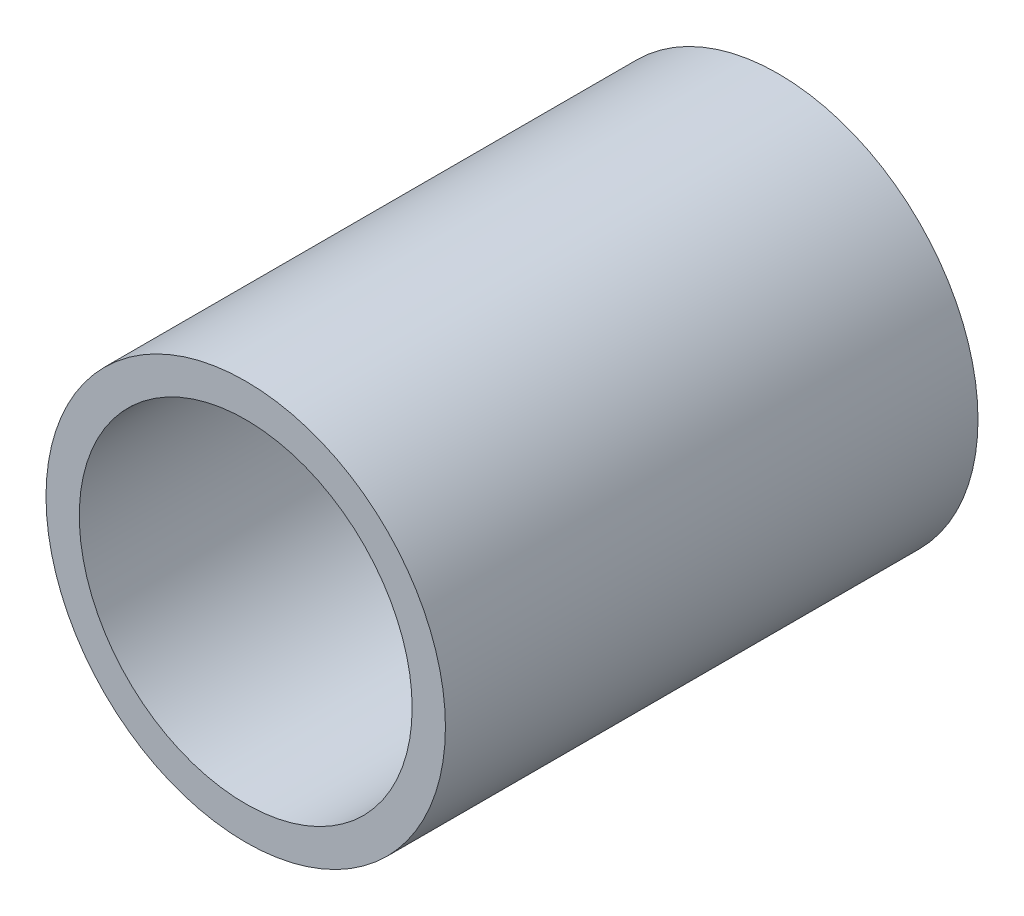
from build123d import *

# Parameters (mm, degrees)
SKETCH1_R      = 4.7625
SKETCH1_R_2    = 3.96875
EXTRUDE1_DEPTH = 6.35


with BuildPart() as part:
    # Sketch1 → Extrude1 (new, symmetric)
    with BuildSketch(Plane.XY):
        Circle(SKETCH1_R)
        Circle(SKETCH1_R_2, mode=Mode.SUBTRACT)
    extrude(amount=EXTRUDE1_DEPTH, both=True)


solid = part.part
